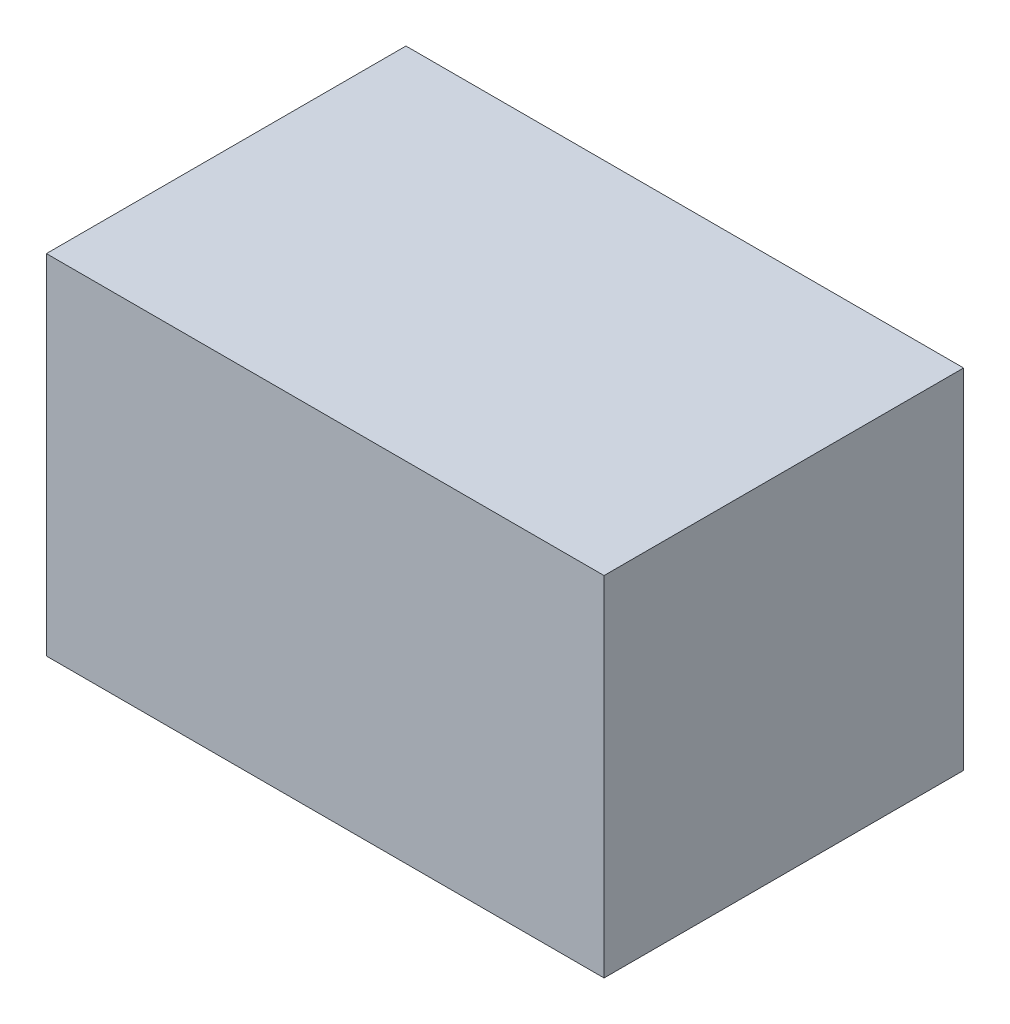
from build123d import *

# Parameters (mm, degrees)
SKETCH1_W           = 152
SKETCH1_H           = 98
BOSS_EXTRUDE1_DEPTH = 95


with BuildPart() as part:
    # Sketch1 → Boss-Extrude1 (new body)
    with BuildSketch(Plane(origin=(0, 0, 0), x_dir=(1, 0, 0), z_dir=(0, 1, 0))):
        with Locations((76, 49)):
            Rectangle(SKETCH1_W, SKETCH1_H)
    extrude(amount=BOSS_EXTRUDE1_DEPTH)


solid = part.part
